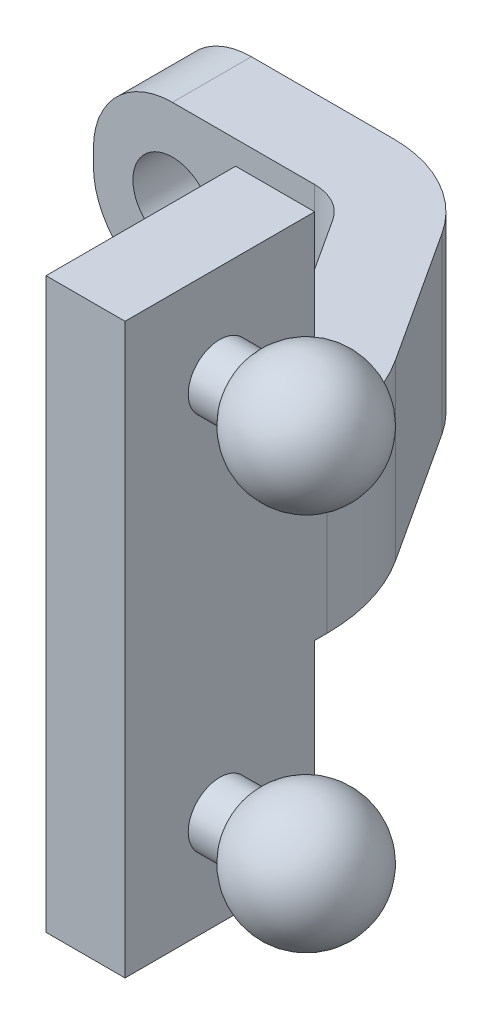
from build123d import *

# Parameters (mm, degrees)
EXTRUDE_1_DEPTH     = 2.75
SKETCH_2_R          = 1.25
CUT_EXTRUDE_1_DEPTH = 10
FILLET_2_R          = 2.5
SKETCH_4_W          = 6
SKETCH_4_H          = 18
EXTRUDE_2_DEPTH     = 2.5
SKETCH_5_R          = 1
EXTRUDE_3_DEPTH     = 1


with BuildPart() as part:
    # 草图1 → 凸台-拉伸1 (new, symmetric)
    with BuildSketch(Plane(origin=(0, 0, 0), x_dir=(1, 0, 0), z_dir=(0, 1, 0))):
        with BuildLine():
            Line((0, 0), (7, 0))
            ThreePointArc((7, 0), (8.907645559, -0.484194485), (10.353455389, -1.819555789))
            Line((10.353455389, -1.819555789), (13.08620622, -6.022441585))
            ThreePointArc((13.08620622, -6.022441585), (13.76673936, -7.496994372), (14, -9.104172255))
            Line((14, -9.104172255), (14, -15.5))
            Line((14, -15.5), (11.5, -15.5))
            Line((11.5, -15.5), (11.5, -9.104172255))
            ThreePointArc((11.5, -9.104172255), (11.369889965, -8.207707378), (10.990296602, -7.385219216))
            Line((10.990296602, -7.385219216), (8.257545771, -3.182333421))
            ThreePointArc((8.257545771, -3.182333421), (7.715367085, -2.681572932), (7, -2.5))
            Line((7, -2.5), (0, -2.5))
            Line((0, -2.5), (0, 0))
        make_face()
    extrude(amount=EXTRUDE_1_DEPTH, both=True)

    # 草图2 → 切除-拉伸1 (cut)
    with BuildSketch(Plane(origin=(0, 0, 0), x_dir=(-1, 0, 0), z_dir=(0, 0, -1))):
        with Locations((-2.5, 0)):
            Circle(SKETCH_2_R)
    extrude(amount=-CUT_EXTRUDE_1_DEPTH, mode=Mode.SUBTRACT)

    # 圆角2
    fillet_2_edges = [part.edges().sort_by_distance(p)[0] for p in [
        (0, -2.75, 1.25),
        (0, 2.75, 1.25),
    ]]
    fillet(fillet_2_edges, radius=FILLET_2_R)

    # 草图4 → 凸台-拉伸2 (add)
    with BuildSketch(Plane.ZY.offset(-11.5)):
        with Locations((12.5, 0)):
            Rectangle(SKETCH_4_W, SKETCH_4_H)
    extrude(amount=-EXTRUDE_2_DEPTH)

    # 草图5 → 凸台-拉伸3 (add)
    with BuildSketch(Plane(origin=(14, 0, 0), x_dir=(0, 0, -1), z_dir=(1, 0, 0))):
        with Locations(Location((-12.5, 6, 0), (0, 0, 180))):
            Circle(SKETCH_5_R)
    extrude_3 = extrude(amount=EXTRUDE_3_DEPTH)

    # 草图6 → 旋转1 (revolve)
    with BuildSketch(Plane(origin=(0, 0, 12.5), x_dir=(-1, 0, 0), z_dir=(0, 0, -1))):
        with BuildLine():
            Line((-15, 6), (-18.732050808, 6))
            ThreePointArc((-18.732050808, 6), (-17.249688898, 7.931851653), (-15, 7))
            Line((-15, 7), (-15, 6))
        make_face()
    revolve_1 = revolve(axis=Axis((15, 6, 12.5), (1, 0, 0)))

    # 镜向1: 凸台-拉伸3, 旋转1 across plane
    add(extrude_3.mirror(Plane.ZX))
    add(revolve_1.mirror(Plane.ZX))


solid = part.part
